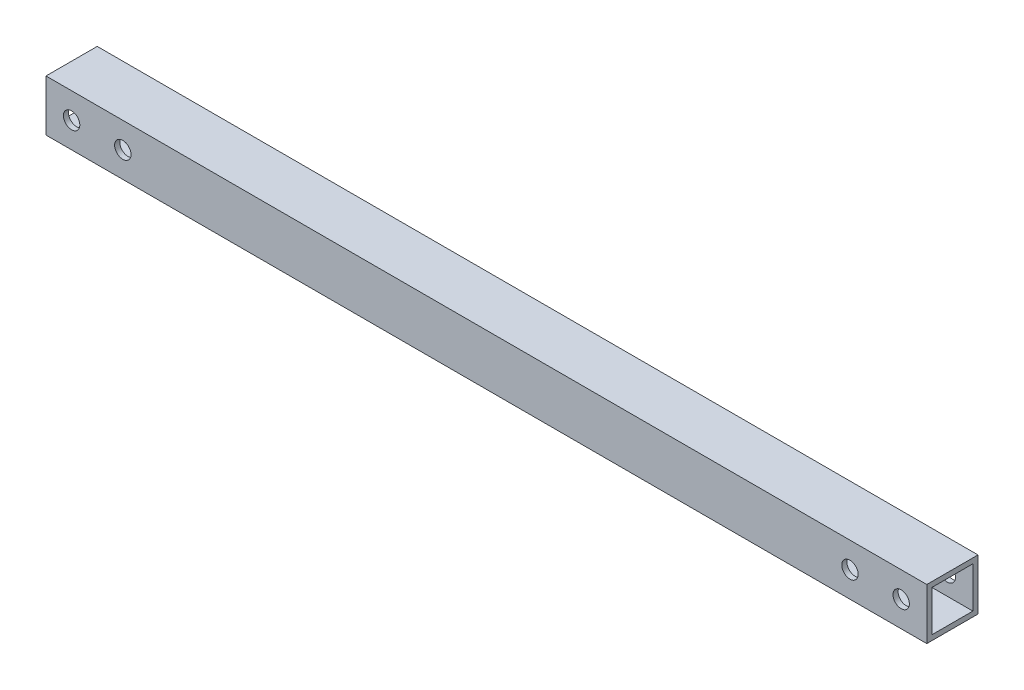
from build123d import *

# Parameters (mm, degrees)
SKETCH_1_W          = 10
SKETCH_1_H          = 10
SKETCH_1_W_2        = 8
SKETCH_1_H_2        = 8
EXTRUDE_1_DEPTH     = 172
SKETCH_2_R          = 1.6
CUT_EXTRUDE_1_DEPTH = 173.362989067


with BuildPart() as part:
    # ｽｹｯﾁ1 → 押し出し-薄板1 (new body)
    with BuildSketch(Plane(origin=(0, 0, 0), x_dir=(0, 0, -1), z_dir=(1, 0, 0))):
        Rectangle(SKETCH_1_W, SKETCH_1_H)
        Rectangle(SKETCH_1_W_2, SKETCH_1_H_2, mode=Mode.SUBTRACT)
    extrude(amount=EXTRUDE_1_DEPTH)

    # ｽｹｯﾁ2 → ｶｯﾄ - 押し出し1 (cut, through all)
    with BuildSketch(Plane.XY.offset(5)):
        with Locations((15, 0)):
            Circle(SKETCH_2_R)
        with Locations((5, 0)):
            Circle(SKETCH_2_R)
        with Locations(Location((167, 0, 0), (0, 0, 90))):
            Circle(SKETCH_2_R)
        with Locations(Location((157, 0, 0), (0, 0, 90))):
            Circle(SKETCH_2_R)
    extrude(amount=-CUT_EXTRUDE_1_DEPTH, mode=Mode.SUBTRACT)


solid = part.part
